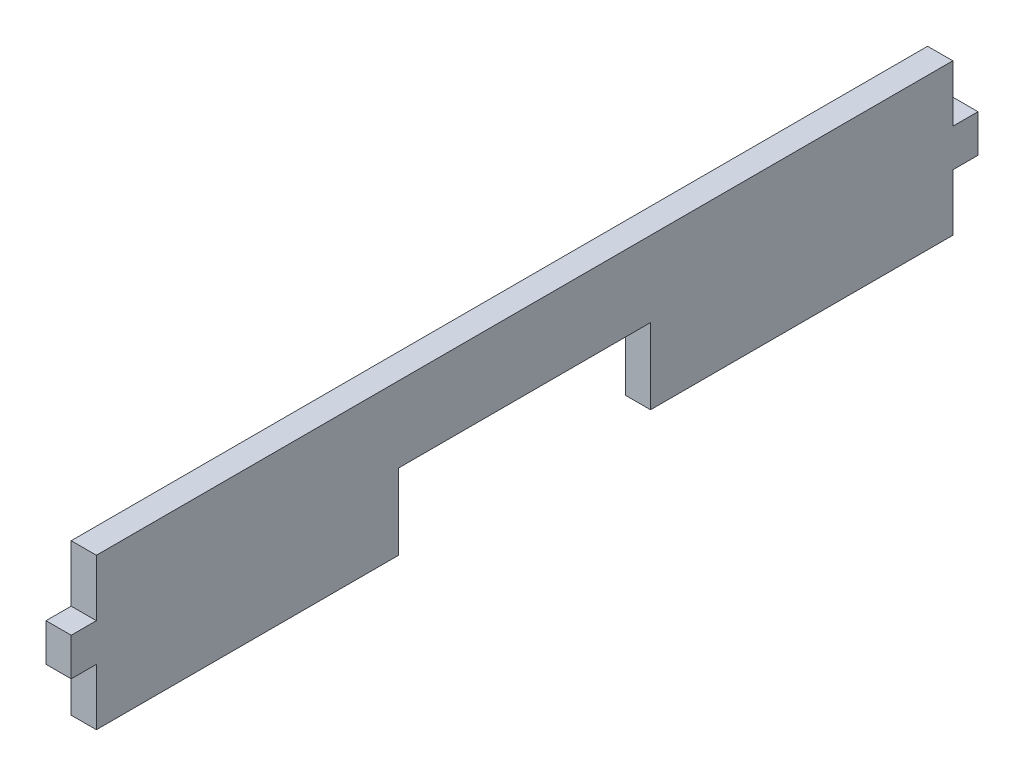
from build123d import *

# Parameters (mm, degrees)
BOSS_EXTRUDE1_DEPTH = 2.54
CUT_EXTRUDE1_REACH  = 48.42
SKETCH2_W           = 25.4
SKETCH2_H           = 7.62


with BuildPart() as part:
    # Sketch1 → Boss-Extrude1 (new body)
    with BuildSketch(Plane(origin=(0, 0, 0), x_dir=(0, 0, -1), z_dir=(1, 0, 0))):
        Polygon((-43.18, 7.62), (-43.18, 1.905), (-45.72, 1.905), (-45.72, -1.905), (-43.18, -1.905), (-43.18, -7.62), (43.18, -7.62), (43.18, -1.905), (45.72, -1.905), (45.72, 1.905), (43.18, 1.905), (43.18, 7.62), align=None)
    extrude(amount=BOSS_EXTRUDE1_DEPTH)

    # Sketch2 → Cut-Extrude1 (cut, up to next)
    with BuildSketch(Plane(origin=(2.54, 0, 0), x_dir=(0, 0, -1), z_dir=(1, 0, 0)), mode=Mode.PRIVATE) as cut_extrude1_sk1:
        with Locations((0, -3.81)):
            Rectangle(SKETCH2_W, SKETCH2_H)
    cut_extrude1_tool1 = extrude(cut_extrude1_sk1.sketch, amount=-CUT_EXTRUDE1_REACH, mode=Mode.PRIVATE) & part.part
    add(cut_extrude1_tool1.solids().sort_by_distance((2.54, -3.81, 0))[0], mode=Mode.SUBTRACT)


solid = part.part
